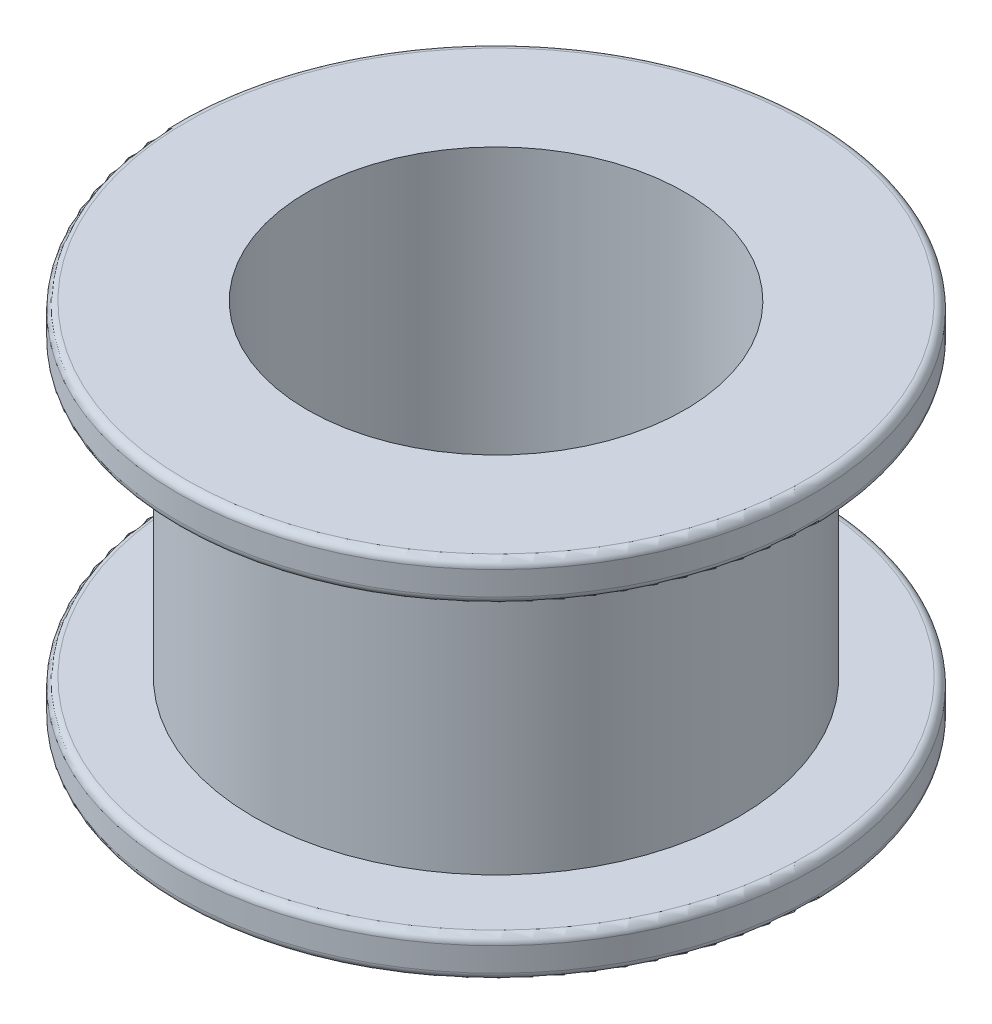
from build123d import *

# Parameters (mm, degrees)
ESBO_O4_R                = 6.1
ESBO_O4_R_2              = 4.75
RESSALTO_EXTRUS_O3_DEPTH = 9.2
ESBO_O4_3_R              = 8
ESBO_O4_3_R_2            = 6.1
RESSALTO_EXTRUS_O4_DEPTH = 1
RESSALTO_EXTRUS_O6_START = -1
ESBO_O5_R                = 8
ESBO_O5_R_2              = 4.75
RESSALTO_EXTRUS_O6_DEPTH = 1
FILETE5_R                = 0.2
FILETE6_R                = 0.2


with BuildPart() as part:
    # Esboço4 → Ressalto-extrusão3 (new body)
    with BuildSketch(Plane(origin=(0, 0, 0), x_dir=(1, 0, 0), z_dir=(0, 1, 0))):
        Circle(ESBO_O4_R)
        Circle(ESBO_O4_R_2, mode=Mode.SUBTRACT)
    extrude(amount=RESSALTO_EXTRUS_O3_DEPTH)

    # Esboço4<3> → Ressalto-extrusão4 (add)
    with BuildSketch(Plane(origin=(0, 0, 0), x_dir=(1, 0, 0), z_dir=(0, 1, 0))):
        Circle(ESBO_O4_3_R)
        Circle(ESBO_O4_3_R_2, mode=Mode.SUBTRACT)
    extrude(amount=RESSALTO_EXTRUS_O4_DEPTH)

    # Esboço5 → Ressalto-extrusão6 (add)
    with BuildSketch(Plane(origin=(0, 9.2, 0), x_dir=(1, 0, 0), z_dir=(0, 1, 0)).offset(RESSALTO_EXTRUS_O6_START)):
        Circle(ESBO_O5_R)
        Circle(ESBO_O5_R_2, mode=Mode.SUBTRACT)
    extrude(amount=RESSALTO_EXTRUS_O6_DEPTH)

    # Filete5
    filete5_edges = [part.edges().sort_by_distance(p)[0] for p in [
        (-8, 9.2, 0),
        (-8, 8.2, 0),
    ]]
    fillet(filete5_edges, radius=FILETE5_R)

    # Filete6
    filete6_edges = [part.edges().sort_by_distance(p)[0] for p in [
        (-8, 0, 0),
        (-8, 1, 0),
    ]]
    fillet(filete6_edges, radius=FILETE6_R)


solid = part.part
